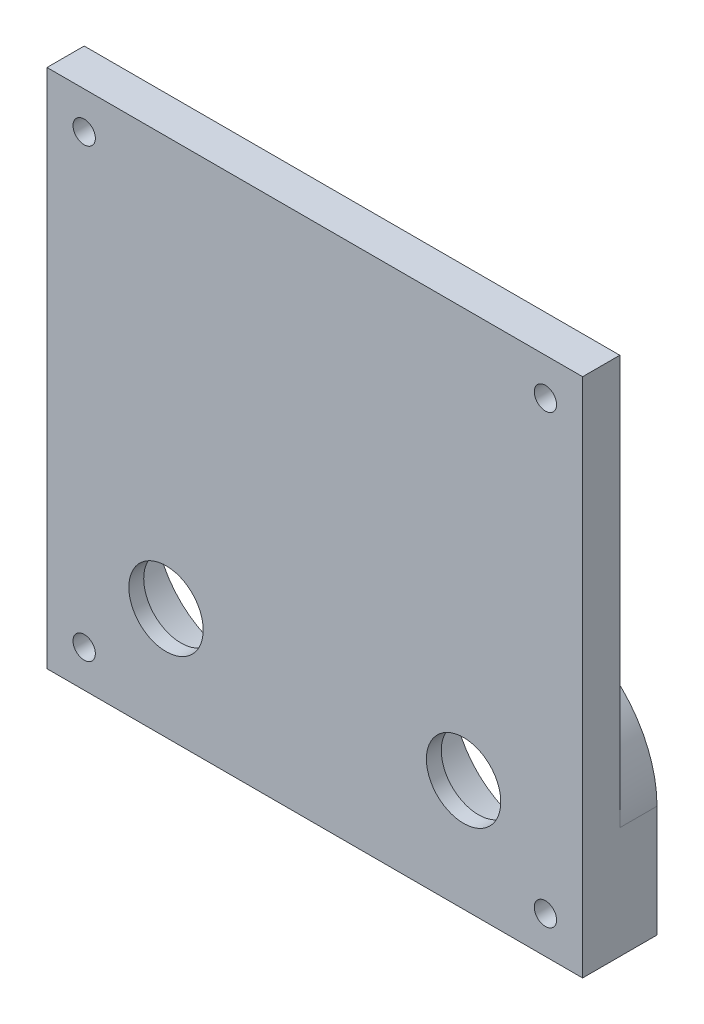
from build123d import *

# Parameters (mm, degrees)
SKETCH1_W               = 70
SKETCH1_H               = 70
BOSS_EXTRUDE1_DEPTH     = 10
SKETCH2_R               = 12
SKETCH2_R_2             = 2
SKETCH2_R_3             = 11.5
CUT_EXTRUDE1_DEPTH      = 10
SKETCH3_W               = 10
SKETCH3_H               = 70
BOSS_EXTRUDE2_DEPTH     = 15
SKETCH4_W               = 10
SKETCH4_H               = 70
BOSS_EXTRUDE3_DEPTH     = 15
SKETCH5_R               = 11.5
SKETCH5_R_2             = 4
BOSS_EXTRUDE4_DEPTH     = 2
SKETCH6_R               = 1.5
SKETCH6_R_2             = 1.648708122
CUT_EXTRUDE3_DEPTH      = 10
BOSS_EXTRUDE5_START     = -10
SKETCH7_R               = 11.986708095
SKETCH7_R_2             = 2
BOSS_EXTRUDE5_DEPTH     = 10
SKETCH8_R               = 12
CUT_EXTRUDE4_DEPTH      = 10
SKETCH9_R               = 2
CUT_EXTRUDE5_DEPTH      = 10
CUT_EXTRUDE7_DEPTH      = 5
SKETCH15_W              = 14
SKETCH15_H              = 70
CUT_EXTRUDE8_DEPTH      = 5
CUT_EXTRUDE9_DEPTH      = 19
CUT_EXTRUDE9_DEPTH_BACK = 48
SKETCH16_R              = 1.5
SKETCH17_R              = 5
CUT_EXTRUDE10_DEPTH     = 19
SKETCH18_W              = 44.558304453
SKETCH18_H              = 39
BOSS_EXTRUDE6_DEPTH     = 5


with BuildPart() as part:
    # Sketch1 → Boss-Extrude1 (new body)
    with BuildSketch(Plane.XY):
        with Locations((35, 35)):
            Rectangle(SKETCH1_W, SKETCH1_H)
    extrude(amount=BOSS_EXTRUDE1_DEPTH)

    # Sketch2 → Cut-Extrude1 (cut)
    with BuildSketch(Plane.XY.offset(10)):
        with Locations((35, 49)):
            Circle(SKETCH2_R)
        with Locations((19.5, 65)):
            Circle(SKETCH2_R_2)
        with Locations((50.5, 65)):
            Circle(SKETCH2_R_2)
        with Locations((19.5, 34)):
            Circle(SKETCH2_R_2)
        with Locations((50.5, 34)):
            Circle(SKETCH2_R_2)
        with Locations((15, 15)):
            Circle(SKETCH2_R_3)
        with Locations((55, 15)):
            Circle(SKETCH2_R_3)
    extrude(amount=-CUT_EXTRUDE1_DEPTH, mode=Mode.SUBTRACT)

    # Sketch3 → Boss-Extrude2 (add)
    with BuildSketch(Plane.ZY):
        with Locations((5, 35)):
            Rectangle(SKETCH3_W, SKETCH3_H)
    extrude(amount=BOSS_EXTRUDE2_DEPTH)

    # Sketch4 → Boss-Extrude3 (add)
    with BuildSketch(Plane(origin=(70, 0, 0), x_dir=(0, 0, -1), z_dir=(1, 0, 0))):
        with Locations((-5, 35)):
            Rectangle(SKETCH4_W, SKETCH4_H)
    extrude(amount=BOSS_EXTRUDE3_DEPTH)

    # Sketch5 → Boss-Extrude4 (add)
    # profile 1 of 2: a face of its own
    with BuildSketch(Plane.XY.offset(10)):
        with Locations((15, 15)):
            Circle(SKETCH5_R)
        with Locations((15, 15)):
            Circle(SKETCH5_R_2, mode=Mode.SUBTRACT)
    # profile 2 of 2: a face of its own
    with BuildSketch(Plane.XY.offset(10)):
        with Locations((55, 15)):
            Circle(SKETCH5_R)
        with Locations((55, 15)):
            Circle(SKETCH5_R_2, mode=Mode.SUBTRACT)
    extrude(amount=-BOSS_EXTRUDE4_DEPTH)

    # Sketch6 → Cut-Extrude3 (cut)
    with BuildSketch(Plane(origin=(0, 0, 0), x_dir=(-1, 0, 0), z_dir=(0, 0, -1))):
        with Locations((-80, 65)):
            Circle(SKETCH6_R)
        with Locations((-80, 5)):
            Circle(SKETCH6_R)
        with Locations((10, 65)):
            Circle(SKETCH6_R_2)
        with Locations((10, 5)):
            Circle(SKETCH6_R)
    extrude(amount=-CUT_EXTRUDE3_DEPTH, mode=Mode.SUBTRACT)

    # Sketch7 → Boss-Extrude5 (add)
    with BuildSketch(Plane(origin=(0, 0, 0), x_dir=(-1, 0, 0), z_dir=(0, 0, -1)).offset(BOSS_EXTRUDE5_START)):
        with Locations((-35, 49)):
            Circle(SKETCH7_R)
        with Locations((-50.5, 65)):
            Circle(SKETCH7_R_2)
        with Locations((-19.5, 65)):
            Circle(SKETCH7_R_2)
        with Locations((-19.5, 34)):
            Circle(SKETCH7_R_2)
        with Locations((-50.5, 34)):
            Circle(SKETCH7_R_2)
    extrude(amount=BOSS_EXTRUDE5_DEPTH)


with BuildPart() as boss_extrude5_piece_1:
    # of the separate pieces the step leaves, piece 1, a body of its own (boss_extrude5_pieces)
    add(part.part.solids().sort_by_distance((-15, 0, 0))[0])


with BuildPart() as boss_extrude5_piece_2:
    # of the separate pieces the step leaves, piece 2, a body of its own (boss_extrude5_pieces)
    add(part.part.solids().sort_by_distance((23.013291905, 49, 10))[0])


with BuildPart() as cut_extrude4_tool:
    # Sketch8 → Cut-Extrude4 (new body)
    with BuildSketch(Plane(origin=(0, 0, 0), x_dir=(-1, 0, 0), z_dir=(0, 0, -1))):
        with Locations((-33.928692494, 49)):
            Circle(SKETCH8_R)
    extrude(amount=-CUT_EXTRUDE4_DEPTH)


with BuildPart() as boss_extrude5_piece_1_1:
    add(boss_extrude5_piece_1.part)

    # Cut-Extrude4: cut by cut_extrude4_tool
    add(cut_extrude4_tool.part, mode=Mode.SUBTRACT)

    # Sketch9 → Cut-Extrude5 (cut)
    with BuildSketch(Plane(origin=(0, 0, 0), x_dir=(-1, 0, 0), z_dir=(0, 0, -1))):
        with Locations((-49.428692494, 64.5)):
            Circle(SKETCH9_R)
        with Locations((-49.428692494, 33.5)):
            Circle(SKETCH9_R)
        with Locations((-18.428692494, 33.5)):
            Circle(SKETCH9_R)
        with Locations((-18.428692494, 64.5)):
            Circle(SKETCH9_R)
    extrude(amount=-CUT_EXTRUDE5_DEPTH, mode=Mode.SUBTRACT)


with BuildPart() as boss_extrude5_piece_2_1:
    add(boss_extrude5_piece_2.part)

    # Cut-Extrude4: cut by cut_extrude4_tool
    add(cut_extrude4_tool.part, mode=Mode.SUBTRACT)


with BuildPart() as cut_extrude7_tool:
    # Sketch14 → Cut-Extrude7 (new body)
    with BuildSketch(Plane(origin=(0, 0, 0), x_dir=(-1, 0, 0), z_dir=(0, 0, -1))):
        with BuildLine():
            Line((-85, 0), (-85, 70))
            Line((-85, 70), (15, 70))
            Line((15, 70), (15, 0))
            Line((15, 0), (1, 0))
            Line((1, 0), (1, 15))
            ThreePointArc((1, 15), (-15, 31), (-31, 15))
            Line((-31, 15), (-31, 0))
            Line((-31, 0), (-39, 0))
            Line((-39, 0), (-39, 15))
            ThreePointArc((-39, 15), (-55, 31), (-71, 15))
            Line((-71, 15), (-71, 0))
            Line((-71, 0), (-85, 0))
        make_face()
    extrude(amount=-CUT_EXTRUDE7_DEPTH)


with BuildPart() as boss_extrude5_piece_1_2:
    add(boss_extrude5_piece_1_1.part)

    # Cut-Extrude7: cut by cut_extrude7_tool
    add(cut_extrude7_tool.part, mode=Mode.SUBTRACT)

    # Sketch15 → Cut-Extrude8 (cut)
    with BuildSketch(Plane(origin=(0, 0, 5), x_dir=(-1, 0, 0), z_dir=(0, 0, -1))):
        with Locations((-78, 35)):
            Rectangle(SKETCH15_W, SKETCH15_H)
        with Locations((8, 35)):
            Rectangle(SKETCH15_W, SKETCH15_H)
    extrude(amount=-CUT_EXTRUDE8_DEPTH, mode=Mode.SUBTRACT)

    # Sketch16 → Cut-Extrude9 (cut, two sides: drawn at the far end of the back side and taken through both)
    with BuildSketch(Plane(origin=(0, 0, 5), x_dir=(-1, 0, 0), z_dir=(0, 0, -1)).offset(-CUT_EXTRUDE9_DEPTH_BACK)):
        with Locations((-66, 65)):
            Circle(SKETCH16_R)
        with Locations((-66, 5)):
            Circle(SKETCH16_R)
        with Locations((-4, 5)):
            Circle(SKETCH16_R)
        with Locations((-4, 65)):
            Circle(SKETCH16_R)
    extrude(amount=CUT_EXTRUDE9_DEPTH + CUT_EXTRUDE9_DEPTH_BACK, mode=Mode.SUBTRACT)

    # Sketch17 → Cut-Extrude10 (cut)
    with BuildSketch(Plane(origin=(0, 0, 8), x_dir=(-1, 0, 0), z_dir=(0, 0, -1))):
        with Locations((-15, 15)):
            Circle(SKETCH17_R)
        with Locations((-55, 15)):
            Circle(SKETCH17_R)
    extrude(amount=-CUT_EXTRUDE10_DEPTH, mode=Mode.SUBTRACT)



with BuildPart() as boss_extrude5_piece_2_2:
    add(boss_extrude5_piece_2_1.part)

    # Cut-Extrude7: cut by cut_extrude7_tool
    add(cut_extrude7_tool.part, mode=Mode.SUBTRACT)


with BuildPart() as boss_extrude5_piece_1_3:
    add(boss_extrude5_piece_1_2.part)

    add(boss_extrude5_piece_2_2.part)  # Boss-Extrude6 merges Boss-Extrude5 piece 2
    # Sketch18 → Boss-Extrude6 (add)
    with BuildSketch(Plane(origin=(0, 0, 5), x_dir=(-1, 0, 0), z_dir=(0, 0, -1))):
        with Locations((-37.279152227, 50.5)):
            Rectangle(SKETCH18_W, SKETCH18_H)
    extrude(amount=-BOSS_EXTRUDE6_DEPTH)


solid = boss_extrude5_piece_1_3.part
